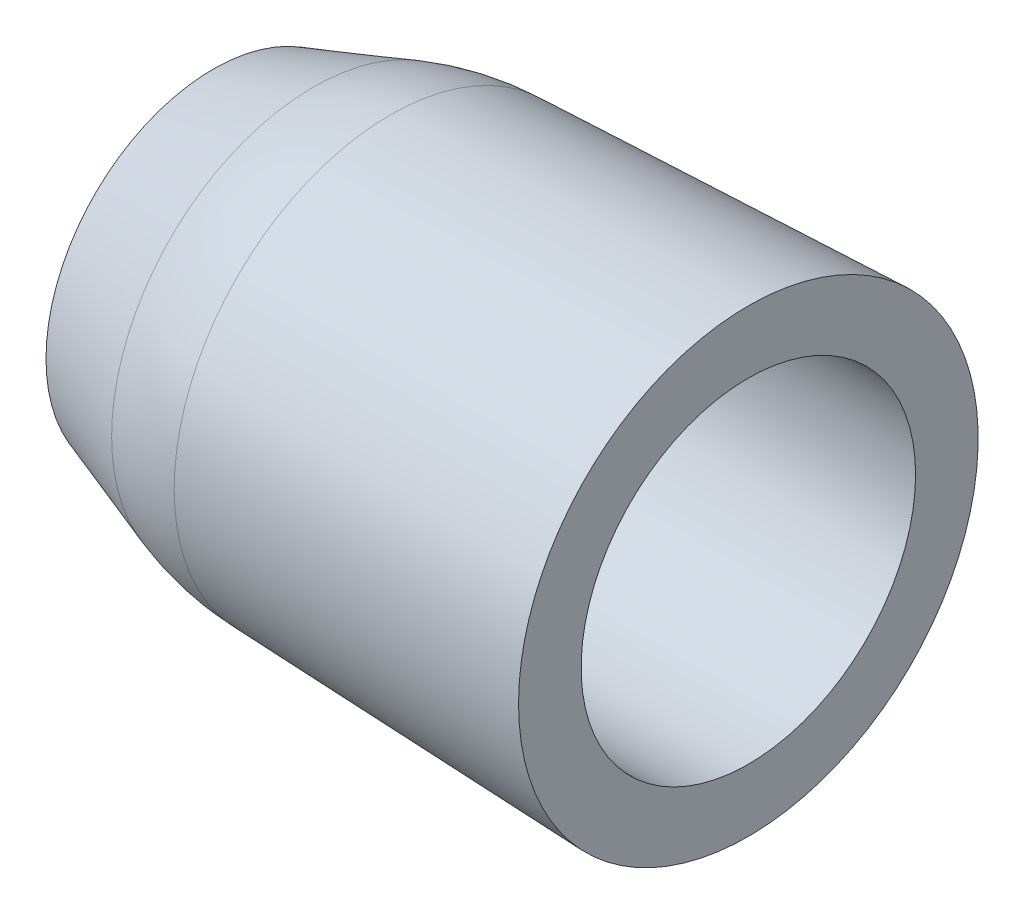
from build123d import *

# Parameters (mm, degrees)
SKETCH3_R          = 7.9375
CUT_EXTRUDE1_DEPTH = 25.146
FILLET1_R          = 12.7


with BuildPart() as part:
    # Sketch2 → Revolve1 (revolve)
    with BuildSketch(Plane.XY, mode=Mode.PRIVATE) as revolve1_sk:
        Polygon((-27.809498475, 7.9375), (-27.809498475, 0), (-2.409498475, 0), (-2.409498475, 10.907816429), (-21.2812055, 10.186700377), align=None)
    revolve(revolve1_sk.sketch.rotate(Axis((-27.809498475, 0, 0), (1, 0, 0)), 90), axis=Axis((-27.809498475, 0, 0), (1, 0, 0)))

    # Sketch3 → Cut-Extrude1 (cut)
    with BuildSketch(Plane(origin=(-2.409498475, 0, 0), x_dir=(0, 0, -1), z_dir=(1, 0, 0))):
        Circle(SKETCH3_R)
    extrude(amount=-CUT_EXTRUDE1_DEPTH, mode=Mode.SUBTRACT)

    # Fillet1
    fillet1_edges = [part.edges().sort_by_distance(p)[0] for p in [
        (-21.2812055, 0, -10.186700377),
    ]]
    fillet(fillet1_edges, radius=FILLET1_R)


solid = part.part
